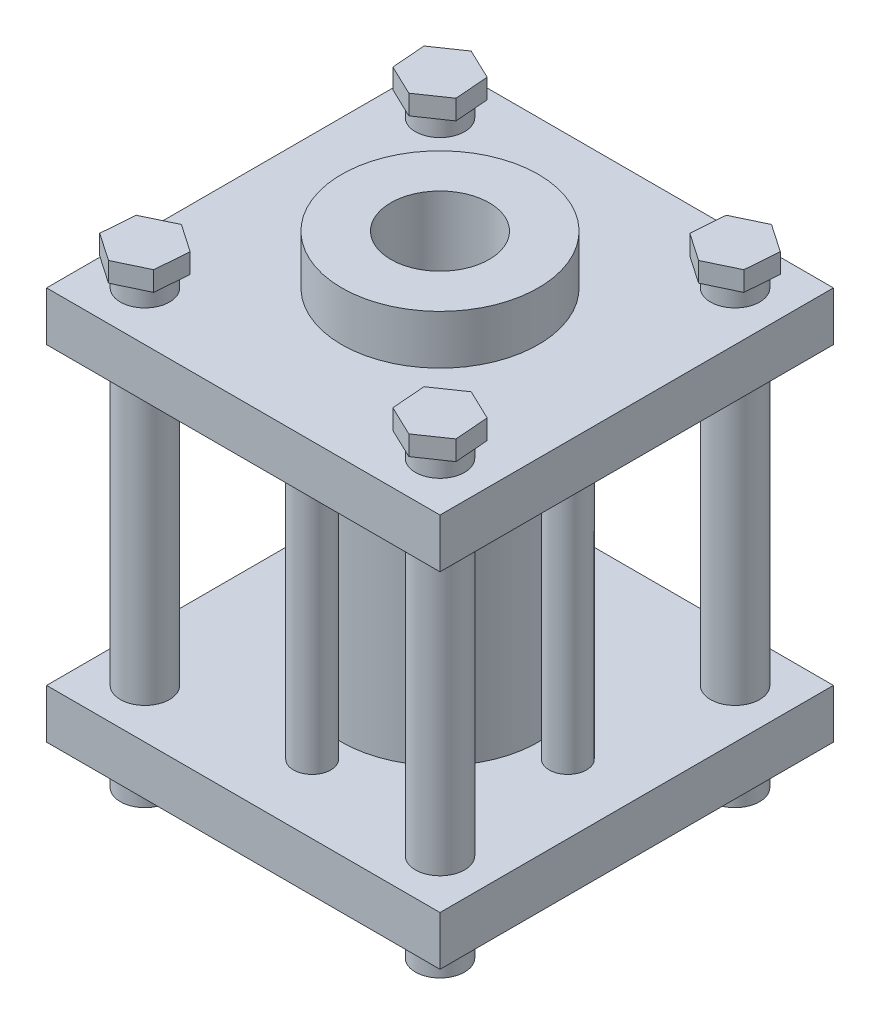
from build123d import *

# Parameters (mm, degrees)
SKETCH1_W                  = 101.6
SKETCH1_H                  = 101.6
SKETCH1_R                  = 6.35
BOSS_EXTRUDE1_DEPTH        = 12.7
SKETCH2_R                  = 25.4
BOSS_EXTRUDE2_DEPTH        = 76.2
SKETCH2_R_2                = 4.826
BOSS_EXTRUDE2_2_DEPTH      = 76.2
BOSS_EXTRUDE2_3_DEPTH      = 76.2
BOSS_EXTRUDE2_4_DEPTH      = 76.2
BOSS_EXTRUDE2_5_DEPTH      = 76.2
SKETCH4_W                  = 101.6
SKETCH4_H                  = 101.6
SKETCH4_R                  = 25.4
BOSS_EXTRUDE4_DEPTH        = 12.7
CUT_EXTRUDE2_DEPTH         = 115.3
CUT_EXTRUDE2_DEPTH_BACK    = 115.3
SKETCH5_R                  = 6.35
SKETCH6_R                  = 25.4
BOSS_EXTRUDE5_DEPTH        = 25.4
CUT_EXTRUDE3_DEPTH         = 136.002851822
CUT_EXTRUDE3_DEPTH_BACK    = 136.002851822
SKETCH7_R                  = 12.7
BOSS_EXTRUDE6_DEPTH        = 15.24
BOSS_EXTRUDE6_DEPTH_BACK   = 101.6
SKETCH9_R                  = 6.35
BOSS_EXTRUDE6_2_DEPTH      = 15.24
BOSS_EXTRUDE6_2_DEPTH_BACK = 101.6
BOSS_EXTRUDE6_3_DEPTH      = 15.24
BOSS_EXTRUDE6_3_DEPTH_BACK = 101.6
BOSS_EXTRUDE6_4_DEPTH      = 15.24
BOSS_EXTRUDE6_4_DEPTH_BACK = 101.6
BOSS_EXTRUDE7_DEPTH        = 5.08


with BuildPart() as part:
    # Sketch1 → Boss-Extrude1 (new body)
    with BuildSketch(Plane(origin=(0, 0, 0), x_dir=(1, 0, 0), z_dir=(0, 1, 0))):
        Rectangle(SKETCH1_W, SKETCH1_H)
        with Locations(Location((-38.1, 38.1, 0), (0, 0, 90))):
            Circle(SKETCH1_R, mode=Mode.SUBTRACT)
        with Locations(Location((38.1, 38.1, 0), (0, 0, 90))):
            Circle(SKETCH1_R, mode=Mode.SUBTRACT)
        with Locations(Location((38.1, -38.1, 0), (0, 0, 90))):
            Circle(SKETCH1_R, mode=Mode.SUBTRACT)
        with Locations(Location((-38.1, -38.1, 0), (0, 0, 90))):
            Circle(SKETCH1_R, mode=Mode.SUBTRACT)
    extrude(amount=BOSS_EXTRUDE1_DEPTH)


with BuildPart() as body_2:
    # Sketch2 → Boss-Extrude2 (new body)
    with BuildSketch(Plane(origin=(0, 12.7, 0), x_dir=(1, 0, 0), z_dir=(0, 1, 0))):
        with Locations(Location((0, 0, 0), (0, 0, 90))):
            Circle(SKETCH2_R)
    extrude(amount=BOSS_EXTRUDE2_DEPTH)


with BuildPart() as body_3:
    # Sketch2 → Boss-Extrude2 2 (new body)
    with BuildSketch(Plane(origin=(0, 12.7, 0), x_dir=(1, 0, 0), z_dir=(0, 1, 0))):
        with Locations(Location((0, 33.02, 0), (0, 0, 90))):
            Circle(SKETCH2_R_2)
    extrude(amount=BOSS_EXTRUDE2_2_DEPTH)


with BuildPart() as body_4:
    # Sketch2 → Boss-Extrude2 3 (new body)
    with BuildSketch(Plane(origin=(0, 12.7, 0), x_dir=(1, 0, 0), z_dir=(0, 1, 0))):
        with Locations(Location((33.021, 0.001, 0), (0, 0, 90))):
            Circle(SKETCH2_R_2)
    extrude(amount=BOSS_EXTRUDE2_3_DEPTH)


with BuildPart() as body_5:
    # Sketch2 → Boss-Extrude2 4 (new body)
    with BuildSketch(Plane(origin=(0, 12.7, 0), x_dir=(1, 0, 0), z_dir=(0, 1, 0))):
        with Locations(Location((0.002, -33.02, 0), (0, 0, 90))):
            Circle(SKETCH2_R_2)
    extrude(amount=BOSS_EXTRUDE2_4_DEPTH)


with BuildPart() as body_6:
    # Sketch2 → Boss-Extrude2 5 (new body)
    with BuildSketch(Plane(origin=(0, 12.7, 0), x_dir=(1, 0, 0), z_dir=(0, 1, 0))):
        with Locations(Location((-33.019, -0.001, 0), (0, 0, 90))):
            Circle(SKETCH2_R_2)
    extrude(amount=BOSS_EXTRUDE2_5_DEPTH)


with BuildPart() as body_7:
    # Sketch4 → Boss-Extrude4 (new body)
    with BuildSketch(Plane(origin=(0, 88.9, 0), x_dir=(1, 0, 0), z_dir=(0, 1, 0))):
        Rectangle(SKETCH4_W, SKETCH4_H)
        with Locations(Location((0, 0, 0), (0, 0, 270))):
            Circle(SKETCH4_R, mode=Mode.SUBTRACT)
    extrude(amount=BOSS_EXTRUDE4_DEPTH)

    # Sketch5 → Cut-Extrude2 (cut, two sides: drawn at the far end of the back side and taken through both)
    with BuildSketch(Plane(origin=(0, 88.9, 0), x_dir=(1, 0, 0), z_dir=(0, 1, 0)).offset(-CUT_EXTRUDE2_DEPTH_BACK)):
        with Locations(Location((-38.1, 38.1, 0), (0, 0, 270))):
            Circle(SKETCH5_R)
        with Locations(Location((38.1, -38.1, 0), (0, 0, 270))):
            Circle(SKETCH5_R)
        with Locations(Location((-38.1, -38.1, 0), (0, 0, 270))):
            Circle(SKETCH5_R)
        with Locations(Location((38.1, 38.1, 0), (0, 0, 270))):
            Circle(SKETCH5_R)
    extrude(amount=CUT_EXTRUDE2_DEPTH + CUT_EXTRUDE2_DEPTH_BACK, mode=Mode.SUBTRACT)

    # Sketch6 → Boss-Extrude5 (add)
    with BuildSketch(Plane(origin=(0, 88.9, 0), x_dir=(1, 0, 0), z_dir=(0, 1, 0))):
        with Locations(Location((0, 0, 0), (0, 0, 270))):
            Circle(SKETCH6_R)
    extrude(amount=BOSS_EXTRUDE5_DEPTH)

    # Sketch7 → Cut-Extrude3 (cut, two sides: drawn at the far end of the back side and taken through both)
    with BuildSketch(Plane(origin=(0, 114.3, 0), x_dir=(1, 0, 0), z_dir=(0, 1, 0)).offset(-CUT_EXTRUDE3_DEPTH_BACK)):
        with Locations(Location((0, 0, 0), (0, 0, 270))):
            Circle(SKETCH7_R)
    extrude(amount=CUT_EXTRUDE3_DEPTH + CUT_EXTRUDE3_DEPTH_BACK, mode=Mode.SUBTRACT)



with BuildPart() as body_8:
    # Sketch9 → Boss-Extrude6 (new, two sides: drawn at the far end of the back side and taken through both)
    with BuildSketch(Plane(origin=(0, 91.44, 0), x_dir=(1, 0, 0), z_dir=(0, 1, 0)).offset(-BOSS_EXTRUDE6_DEPTH_BACK)):
        with Locations(Location((-38.1, -38.1, 0), (0, 0, 270))):
            Circle(SKETCH9_R)
    extrude(amount=BOSS_EXTRUDE6_DEPTH + BOSS_EXTRUDE6_DEPTH_BACK)


with BuildPart() as body_9:
    # Sketch9 → Boss-Extrude6 2 (new, two sides: drawn at the far end of the back side and taken through both)
    with BuildSketch(Plane(origin=(0, 91.44, 0), x_dir=(1, 0, 0), z_dir=(0, 1, 0)).offset(-BOSS_EXTRUDE6_2_DEPTH_BACK)):
        with Locations(Location((38.1, -38.1, 0), (0, 0, 270))):
            Circle(SKETCH9_R)
    extrude(amount=BOSS_EXTRUDE6_2_DEPTH + BOSS_EXTRUDE6_2_DEPTH_BACK)


with BuildPart() as body_10:
    # Sketch9 → Boss-Extrude6 3 (new, two sides: drawn at the far end of the back side and taken through both)
    with BuildSketch(Plane(origin=(0, 91.44, 0), x_dir=(1, 0, 0), z_dir=(0, 1, 0)).offset(-BOSS_EXTRUDE6_3_DEPTH_BACK)):
        with Locations(Location((38.1, 38.1, 0), (0, 0, 270))):
            Circle(SKETCH9_R)
    extrude(amount=BOSS_EXTRUDE6_3_DEPTH + BOSS_EXTRUDE6_3_DEPTH_BACK)


with BuildPart() as body_11:
    # Sketch9 → Boss-Extrude6 4 (new, two sides: drawn at the far end of the back side and taken through both)
    with BuildSketch(Plane(origin=(0, 91.44, 0), x_dir=(1, 0, 0), z_dir=(0, 1, 0)).offset(-BOSS_EXTRUDE6_4_DEPTH_BACK)):
        with Locations(Location((-38.1, 38.1, 0), (0, 0, 270))):
            Circle(SKETCH9_R)
    extrude(amount=BOSS_EXTRUDE6_4_DEPTH + BOSS_EXTRUDE6_4_DEPTH_BACK)


with BuildPart() as body_7_1:
    add(body_7.part)

    add(body_8.part)  # Boss-Extrude7 merges body 8

    add(body_9.part)  # Boss-Extrude7 merges body 9

    add(body_10.part)  # Boss-Extrude7 merges body 10

    add(body_11.part)  # Boss-Extrude7 merges body 11
    # Sketch10 → Boss-Extrude7 (add)
    with BuildSketch(Plane(origin=(0, 106.68, 0), x_dir=(1, 0, 0), z_dir=(0, 1, 0))):
        Polygon((-30.878983534, -43.057961512), (-30.195771147, -34.325397056), (-37.416787612, -29.367435544), (-45.321016466, -33.142038488), (-46.004228853, -41.874602944), (-38.783212388, -46.832564456), align=None)
        Polygon((-38.783212388, 46.832564456), (-30.878983534, 43.057961512), (-30.195771147, 34.325397056), (-37.416787612, 29.367435544), (-45.321016466, 33.142038488), (-46.004228853, 41.874602944), align=None)
        Polygon((46.004228853, 41.874602944), (38.783212388, 46.832564456), (30.878983534, 43.057961512), (30.195771147, 34.325397056), (37.416787612, 29.367435544), (45.321016466, 33.142038488), align=None)
        Polygon((38.783212388, -46.832564456), (30.878983534, -43.057961512), (30.195771147, -34.325397056), (37.416787612, -29.367435544), (45.321016466, -33.142038488), (46.004228853, -41.874602944), align=None)
    extrude(amount=BOSS_EXTRUDE7_DEPTH)


solid = Compound([part.part, body_2.part, body_3.part, body_4.part, body_5.part, body_6.part, body_7_1.part])
